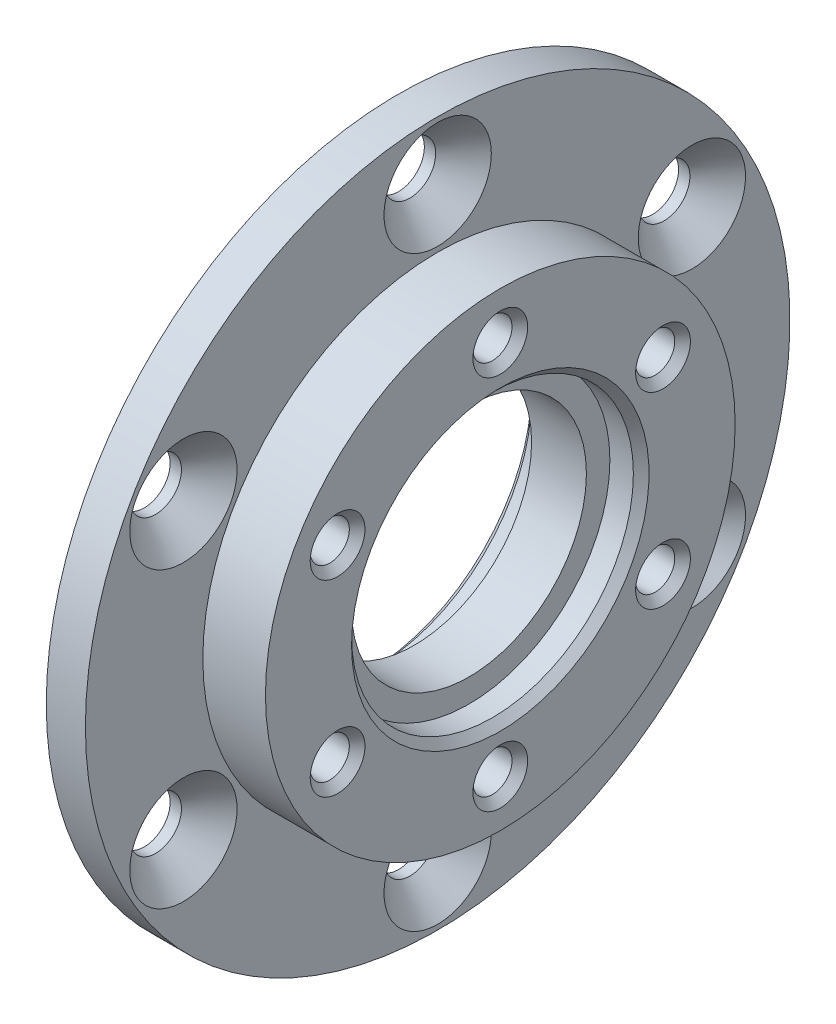
from build123d import *

# Parameters (mm, degrees)
PATTERN_CIRCULAR_1_COUNT = 6
PATTERN_CIRCULAR_2_COUNT = 6
CUT_EXTRUDE_START        = -4
SKETCH_8_R               = 18
SKETCH_8_R_2             = 15
CUT_EXTRUDE_1_DEPTH      = 4
CHAMFER_1_SIZE           = 1
CHAMFER_2_SIZE           = 1


with BuildPart() as part:
    # Эскиз1 → Повернуть1 (revolve)
    with BuildSketch(Plane.XY, mode=Mode.PRIVATE) as revolve_1_sk:
        Polygon((0, 20), (0, 27.5), (4, 27.5), (4, 45), (9, 45), (9, 30), (17, 30), (17, 15), (6, 15), (6, 20), align=None)
    revolve(revolve_1_sk.sketch.rotate(Axis((0, 0, 0), (-1, 0, 0)), 270), axis=Axis((0, 0, 0), (-1, 0, 0)))

    # Эскиз3 → Hole Wizard M61 (revolve, cut)
    with BuildSketch(Plane(origin=(17, 24, 0), x_dir=(0, 0, -1), z_dir=(0, 1, 0))):
        Polygon((0, 0), (0, 10), (2.5, 8.497848452), (2.5, 0), align=None)
    hole_wizard_m61 = revolve(axis=Axis((23.35, 24, 0), (-1, 0, 0)), mode=Mode.SUBTRACT)

    # Круговой массив1: Hole Wizard M61 ×6 about axis
    pattern_circular_1_axis = Axis((0, 0, 0), (1, 0, 0))
    for i in range(1, PATTERN_CIRCULAR_1_COUNT):
        add(hole_wizard_m61.rotate(pattern_circular_1_axis, i * 360 / PATTERN_CIRCULAR_1_COUNT), mode=Mode.SUBTRACT)

    # Эскиз6 → Hole Wizard M61 2 (revolve, cut)
    with BuildSketch(Plane(origin=(9, 37.5, 0), x_dir=(0, 0, -1), z_dir=(0, 1, 0))):
        Polygon((0, 0), (0, 13), (3.3, 11.017159957), (3.3, 3.555), (6.855, 0), align=None)
    hole_wizard_m61_2 = revolve(axis=Axis((15.35, 37.5, 0), (-1, 0, 0)), mode=Mode.SUBTRACT)

    # Круговой массив2: Hole Wizard M61 2 ×6 about axis
    pattern_circular_2_axis = Axis((0, 0, 0), (1, 0, 0))
    for i in range(1, PATTERN_CIRCULAR_2_COUNT):
        add(hole_wizard_m61_2.rotate(pattern_circular_2_axis, i * 360 / PATTERN_CIRCULAR_2_COUNT), mode=Mode.SUBTRACT)

    # Эскиз8 → Вырез-Вытянуть1 (cut)
    with BuildSketch(Plane(origin=(17, 0, 0), x_dir=(0, 0, -1), z_dir=(1, 0, 0)).offset(CUT_EXTRUDE_START)):
        Circle(SKETCH_8_R)
        with Locations(Location((0, 0, 0), (0, 0, 180))):
            Circle(SKETCH_8_R_2, mode=Mode.SUBTRACT)
    extrude(amount=CUT_EXTRUDE_1_DEPTH, mode=Mode.SUBTRACT)

    # Фаска1
    chamfer_1_edges = [part.edges().sort_by_distance(p)[0] for p in [
        (17, 24, 2.5),
        (17, 14.165063509, -19.534609691),
        (17, -9.834936491, -22.034609691),
        (17, -24, -2.5),
        (17, -14.165063509, 19.534609691),
        (17, 9.834936491, 22.034609691),
    ]]
    chamfer(chamfer_1_edges, length=CHAMFER_1_SIZE)

    # Фаска2
    chamfer_2_edges = [part.edges().sort_by_distance(p)[0] for p in [
        (17, 0, 18),
        (0, 0, -27.5),
        (0, 0, -20),
    ]]
    chamfer(chamfer_2_edges, length=CHAMFER_2_SIZE)


solid = part.part
